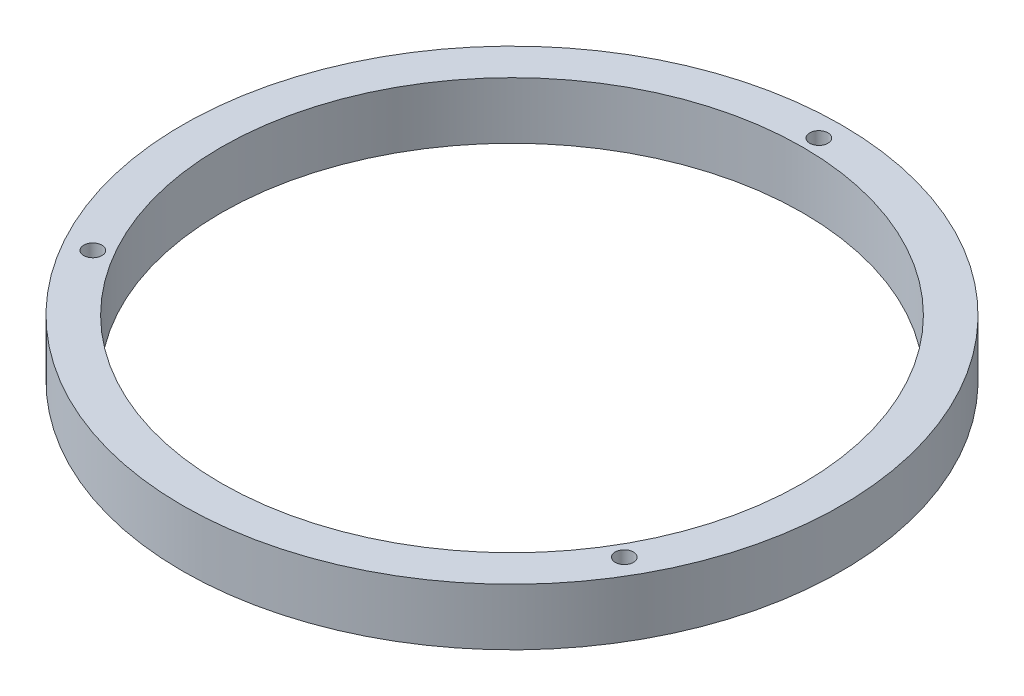
from build123d import *

# Parameters (mm, degrees)
SKETCH1_R           = 72.5
SKETCH1_R_2         = 64
SKETCH1_R_3         = 2
BOSS_EXTRUDE1_DEPTH = 12.5


with BuildPart() as part:
    # Sketch1 → Boss-Extrude1 (new body)
    with BuildSketch(Plane(origin=(0, 0, 0), x_dir=(1, 0, 0), z_dir=(0, 1, 0))):
        with Locations(Location((0, 0, 0), (0, 0, 270))):
            Circle(SKETCH1_R)
        with Locations(Location((0, 0, 0), (0, 0, 270))):
            Circle(SKETCH1_R_2, mode=Mode.SUBTRACT)
        with Locations(Location((0, 67.5, 0), (0, 0, 270))):
            Circle(SKETCH1_R_3, mode=Mode.SUBTRACT)
        with Locations(Location((58.456714755, -33.75, 0), (0, 0, 270))):
            Circle(SKETCH1_R_3, mode=Mode.SUBTRACT)
        with Locations(Location((-58.456714755, -33.75, 0), (0, 0, 270))):
            Circle(SKETCH1_R_3, mode=Mode.SUBTRACT)
    extrude(amount=BOSS_EXTRUDE1_DEPTH)


solid = part.part
